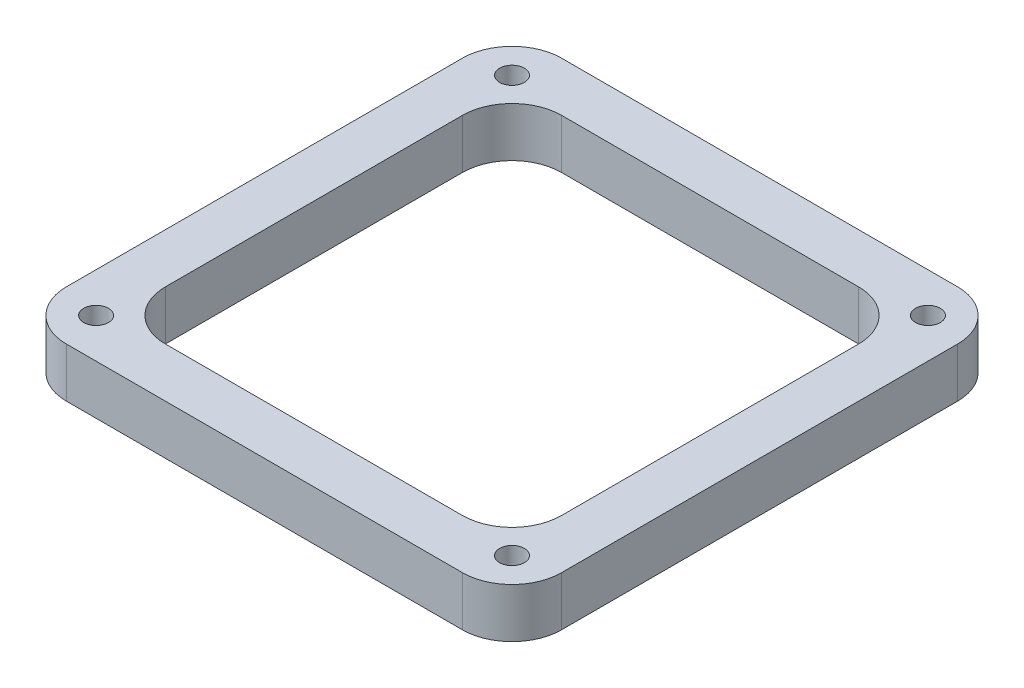
from build123d import *

# Parameters (mm, degrees)
BOSS_EXTRUDE1_DEPTH = 10
CUT_EXTRUDE1_DEPTH  = 10
SKETCH3_R           = 2.5
CUT_EXTRUDE2_DEPTH  = 7


with BuildPart() as part:
    # Sketch1 → Boss-Extrude1 (new body)
    with BuildSketch(Plane(origin=(0, 0, 0), x_dir=(1, 0, 0), z_dir=(0, 1, 0))):
        with BuildLine():
            Line((-40, 50), (40, 50))
            ThreePointArc((40, 50), (47.071067812, 47.071067812), (50, 40))
            Line((50, 40), (50, -40))
            ThreePointArc((50, -40), (47.071067812, -47.071067812), (40, -50))
            Line((40, -50), (-40, -50))
            ThreePointArc((-40, -50), (-47.071067812, -47.071067812), (-50, -40))
            Line((-50, -40), (-50, 40))
            ThreePointArc((-50, 40), (-47.071067812, 47.071067812), (-40, 50))
        make_face()
    extrude(amount=BOSS_EXTRUDE1_DEPTH)

    # Sketch2 → Cut-Extrude1 (cut)
    with BuildSketch(Plane(origin=(0, 10, 0), x_dir=(1, 0, 0), z_dir=(0, 1, 0))):
        with BuildLine():
            Line((-30, -40), (30, -40))
            ThreePointArc((30, -40), (37.071067812, -37.071067812), (40, -30))
            Line((40, -30), (40, 30))
            ThreePointArc((40, 30), (37.071067812, 37.071067812), (30, 40))
            Line((30, 40), (-30, 40))
            ThreePointArc((-30, 40), (-37.071067812, 37.071067812), (-40, 30))
            Line((-40, 30), (-40, -30))
            ThreePointArc((-40, -30), (-37.071067812, -37.071067812), (-30, -40))
        make_face()
    extrude(amount=-CUT_EXTRUDE1_DEPTH, mode=Mode.SUBTRACT)

    # Sketch3 → Cut-Extrude2 (cut)
    with BuildSketch(Plane(origin=(0, 10, 0), x_dir=(1, 0, 0), z_dir=(0, 1, 0))):
        with Locations(Location((-42, 42, 0), (0, 0, 270))):
            Circle(SKETCH3_R)
        with Locations(Location((42, 42, 0), (0, 0, 270))):
            Circle(SKETCH3_R)
        with Locations(Location((42.000013816, -42, 0), (0, 0, 270))):
            Circle(SKETCH3_R)
        with Locations(Location((-41.999986184, -42, 0), (0, 0, 270))):
            Circle(SKETCH3_R)
    extrude(amount=-CUT_EXTRUDE2_DEPTH, mode=Mode.SUBTRACT)


solid = part.part
